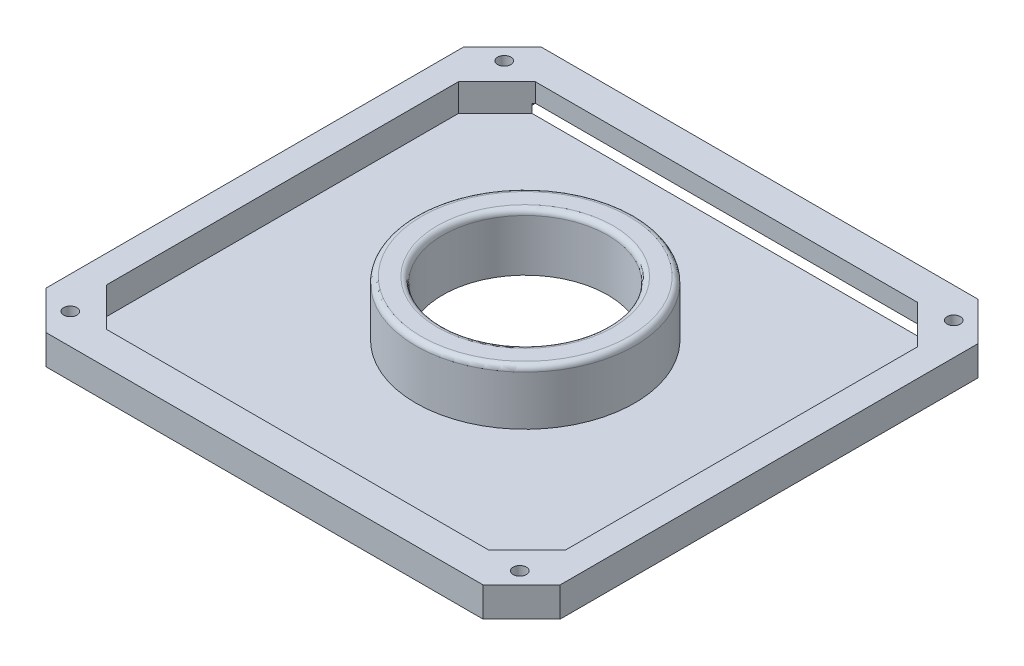
from build123d import *

# Parameters (mm, degrees)
SKETCH1_W             = 93.5
SKETCH1_H             = 90
BOSS_EXTRUDE1_DEPTH   = 5.4
CUT_EXTRUDE1_REACH    = 66.978
SKETCH2_W             = 83.5
SKETCH2_H             = 78
CHAMFER1_SIZE         = 7
CHAMFER2_SIZE         = 7
CHAMFER3_SIZE         = 7
CHAMFER4_SIZE         = 7
CHAMFER5_SIZE         = 7
CHAMFER6_SIZE         = 7
CHAMFER7_SIZE         = 7
CHAMFER8_SIZE         = 7
CUT_EXTRUDE2_REACH    = 67.081
SKETCH4_W             = 2
SKETCH4_H             = 6.295211976
CUT_EXTRUDE3_DEPTH    = 73.5
SKETCH5_R             = 19.9
BOSS_EXTRUDE2_DEPTH   = 10
F_2_CLEARANCE_HOLE1_D = 2.4
F_2_CLEARANCE_HOLE2_D = 2.4
F_2_CLEARANCE_HOLE3_D = 2.4
F_2_CLEARANCE_HOLE4_D = 2.4
HOLE1_D               = 30
FILLET1_R             = 1
FILLET2_R             = 1


with BuildPart() as part:
    # Sketch1 → Boss-Extrude1 (new body)
    with BuildSketch(Plane(origin=(0, 5.4, 0), x_dir=(1, 0, 0), z_dir=(0, 1, 0))):
        Rectangle(SKETCH1_W, SKETCH1_H)
    extrude(amount=-BOSS_EXTRUDE1_DEPTH)

    # Sketch2 → Cut-Extrude1 (cut, up to next)
    with BuildSketch(Plane.XZ.offset(-2), mode=Mode.PRIVATE) as cut_extrude1_sk1:
        Rectangle(SKETCH2_W, SKETCH2_H)
    cut_extrude1_tool1 = extrude(cut_extrude1_sk1.sketch, amount=-CUT_EXTRUDE1_REACH, mode=Mode.PRIVATE) & part.part
    add(cut_extrude1_tool1.solids().sort_by_distance((0, 2, 0))[0], mode=Mode.SUBTRACT)

    # Chamfer1
    chamfer1_edges = [part.edges().sort_by_distance(p)[0] for p in [
        (41.75, 3.7, -39),
    ]]
    chamfer(chamfer1_edges, length=CHAMFER1_SIZE)

    # Chamfer2
    chamfer2_edges = [part.edges().sort_by_distance(p)[0] for p in [
        (41.75, 3.7, 39),
    ]]
    chamfer(chamfer2_edges, length=CHAMFER2_SIZE)

    # Chamfer3
    chamfer3_edges = [part.edges().sort_by_distance(p)[0] for p in [
        (46.75, 2.7, 45),
    ]]
    chamfer(chamfer3_edges, length=CHAMFER3_SIZE)

    # Chamfer4
    chamfer4_edges = [part.edges().sort_by_distance(p)[0] for p in [
        (46.75, 2.7, -45),
    ]]
    chamfer(chamfer4_edges, length=CHAMFER4_SIZE)

    # Chamfer5
    chamfer5_edges = [part.edges().sort_by_distance(p)[0] for p in [
        (-46.75, 2.7, -45),
    ]]
    chamfer(chamfer5_edges, length=CHAMFER5_SIZE)

    # Chamfer6
    chamfer6_edges = [part.edges().sort_by_distance(p)[0] for p in [
        (-41.75, 3.7, -39),
    ]]
    chamfer(chamfer6_edges, length=CHAMFER6_SIZE)

    # Chamfer7
    chamfer7_edges = [part.edges().sort_by_distance(p)[0] for p in [
        (-46.75, 2.7, 45),
    ]]
    chamfer(chamfer7_edges, length=CHAMFER7_SIZE)

    # Chamfer8
    chamfer8_edges = [part.edges().sort_by_distance(p)[0] for p in [
        (-41.75, 3.7, 39),
    ]]
    chamfer(chamfer8_edges, length=CHAMFER8_SIZE)

    # Sketch3 → Cut-Extrude2 (cut, up to next)
    with BuildSketch(Plane.XZ.offset(-0.4), mode=Mode.PRIVATE) as cut_extrude2_sk1:
        Polygon((-41.75, -32), (-35.045211976, -38.704788024), (35.045211976, -38.704788024), (41.75, -32), (41.75, 32), (34.75, 39), (-34.75, 39), (-41.75, 32), align=None)
    cut_extrude2_tool1 = extrude(cut_extrude2_sk1.sketch, amount=-CUT_EXTRUDE2_REACH, mode=Mode.PRIVATE) & part.part
    add(cut_extrude2_tool1.solids().sort_by_distance((0, 0.4, 0.125192))[0], mode=Mode.SUBTRACT)

    # Sketch4 → Cut-Extrude3 (cut)
    with BuildSketch(Plane(origin=(-36.75, 0, 0), x_dir=(0, -1, 0), z_dir=(-1, 0, 0))):
        with Locations((-1, -41.852394012)):
            Rectangle(SKETCH4_W, SKETCH4_H)
    extrude(amount=-CUT_EXTRUDE3_DEPTH, mode=Mode.SUBTRACT)

    # Sketch5 → Boss-Extrude2 (add)
    with BuildSketch(Plane(origin=(0, 10.4, 0), x_dir=(1, 0, 0), z_dir=(0, 1, 0))):
        with Locations(Location((0, 2.404788024, 0), (0, 0, 90))):
            Circle(SKETCH5_R)
    extrude(amount=-BOSS_EXTRUDE2_DEPTH)

    # #2 Clearance Hole1 (through all)
    with Locations(Plane(origin=(0, 5.4, 0), x_dir=(1, 0, 0), z_dir=(0, 1, 0))):
        with Locations((40.871180413, -39.457859948)):
            Hole(F_2_CLEARANCE_HOLE1_D / 2)

    # #2 Clearance Hole2 (through all)
    with Locations(Plane(origin=(0, 5.4, 0), x_dir=(1, 0, 0), z_dir=(0, 1, 0))):
        with Locations((40.871180413, 39.457859948)):
            Hole(F_2_CLEARANCE_HOLE2_D / 2)

    # #2 Clearance Hole3 (through all)
    with Locations(Plane(origin=(0, 5.4, 0), x_dir=(1, 0, 0), z_dir=(0, 1, 0))):
        with Locations((-40.871180413, 39.457859948)):
            Hole(F_2_CLEARANCE_HOLE3_D / 2)

    # #2 Clearance Hole4 (through all)
    with Locations(Plane(origin=(0, 5.4, 0), x_dir=(1, 0, 0), z_dir=(0, 1, 0))):
        with Locations((-40.871180413, -39.457859948)):
            Hole(F_2_CLEARANCE_HOLE4_D / 2)

    # Hole1 (through all)
    with Locations(Plane(origin=(0, 10.4, 0), x_dir=(1, 0, 0), z_dir=(0, 1, 0))):
        with Locations((0, 2.404788024)):
            Hole(HOLE1_D / 2)

    # Fillet1
    fillet1_edges = [part.edges().sort_by_distance(p)[0] for p in [
        (36.75, 1, -38.704788024),
        (-36.75, 1, -38.704788024),
    ]]
    fillet(fillet1_edges, radius=FILLET1_R)

    # Fillet2
    fillet2_edges = [part.edges().sort_by_distance(p)[0] for p in [
        (0, 10.4, 17.495211976),
        (15, 10.4, -2.404788024),
    ]]
    fillet(fillet2_edges, radius=FILLET2_R)


solid = part.part
